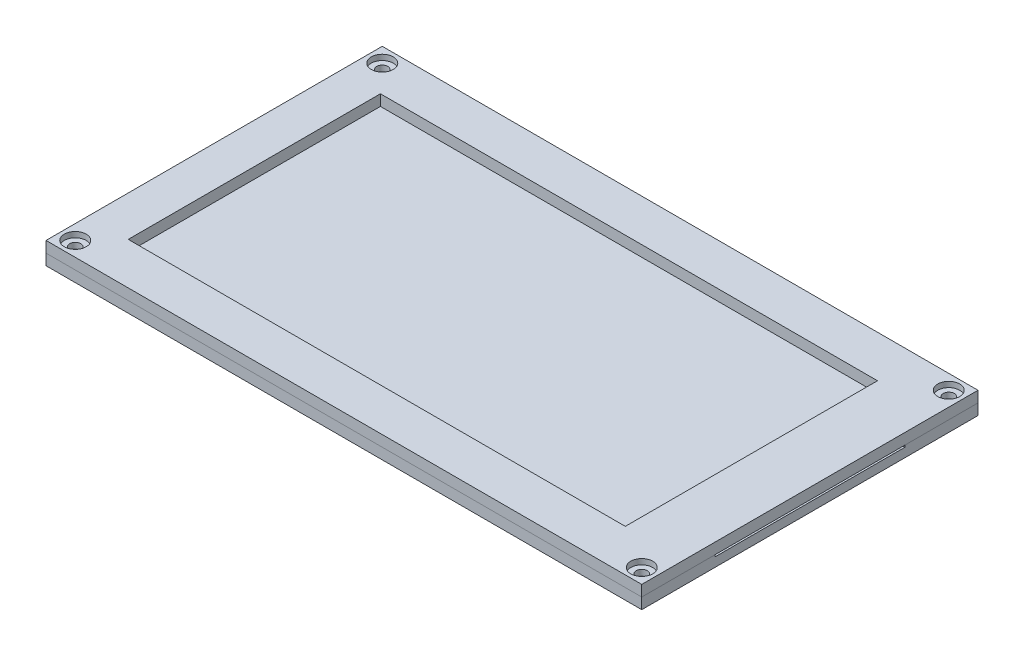
from build123d import *

# Parameters (mm, degrees)
SKETCH1_W           = 163
SKETCH1_H           = 92
SKETCH1_R           = 1.5
SKETCH1_W_2         = 136
SKETCH1_H_2         = 69
BOSS_EXTRUDE1_DEPTH = 3
SKETCH2_R           = 3
CUT_EXTRUDE1_DEPTH  = 1.5
SKETCH3_R           = 1.5
BOSS_EXTRUDE2_DEPTH = 0.5
BOSS_EXTRUDE3_START = 2.5
SKETCH4_W           = 163
SKETCH4_H           = 92
SKETCH4_R           = 1.5
BOSS_EXTRUDE3_DEPTH = 2.5


with BuildPart() as part:
    # Sketch1 → Boss-Extrude1 (new body)
    with BuildSketch(Plane(origin=(0, 0, 0), x_dir=(1, 0, 0), z_dir=(0, 1, 0))):
        with Locations((2.5, 0)):
            Rectangle(SKETCH1_W, SKETCH1_H)
        with Locations(Location((-75, 42, 0), (0, 0, 270))):
            Circle(SKETCH1_R, mode=Mode.SUBTRACT)
        with Locations(Location((80, 42, 0), (0, 0, 90))):
            Circle(SKETCH1_R, mode=Mode.SUBTRACT)
        with Locations(Location((80, -42, 0), (0, 0, 270))):
            Circle(SKETCH1_R, mode=Mode.SUBTRACT)
        with Locations(Location((-75, -42, 0), (0, 0, 90))):
            Circle(SKETCH1_R, mode=Mode.SUBTRACT)
        Rectangle(SKETCH1_W_2, SKETCH1_H_2, mode=Mode.SUBTRACT)
    extrude(amount=BOSS_EXTRUDE1_DEPTH)

    # Sketch2 → Cut-Extrude1 (cut)
    with BuildSketch(Plane(origin=(0, 3, 0), x_dir=(1, 0, 0), z_dir=(0, 1, 0))):
        with Locations(Location((-75, 42, 0), (0, 0, 270))):
            Circle(SKETCH2_R)
        with Locations(Location((80, 42, 0), (0, 0, 90))):
            Circle(SKETCH2_R)
        with Locations(Location((80, -42, 0), (0, 0, 270))):
            Circle(SKETCH2_R)
        with Locations(Location((-75, -42, 0), (0, 0, 90))):
            Circle(SKETCH2_R)
    extrude(amount=-CUT_EXTRUDE1_DEPTH, mode=Mode.SUBTRACT)


with BuildPart() as body_2:
    # Sketch3 → Boss-Extrude2 (new body)
    with BuildSketch(Plane.XZ):
        Polygon((84, 46), (-79, 46), (-79, -46), (84, -46), (84, -26), (76.5, -26), (76.5, -38.5), (-71.5, -38.5), (-71.5, 38.5), (76.5, 38.5), (76.5, 26), (84, 26), align=None)
        with Locations(Location((-75, -42, 0), (0, 0, 270))):
            Circle(SKETCH3_R, mode=Mode.SUBTRACT)
        with Locations(Location((80, -42, 0), (0, 0, 270))):
            Circle(SKETCH3_R, mode=Mode.SUBTRACT)
        with Locations(Location((-75, 42, 0), (0, 0, 270))):
            Circle(SKETCH3_R, mode=Mode.SUBTRACT)
        with Locations(Location((80, 42, 0), (0, 0, 270))):
            Circle(SKETCH3_R, mode=Mode.SUBTRACT)
    extrude(amount=BOSS_EXTRUDE2_DEPTH)

    # Sketch4 → Boss-Extrude3 (add)
    with BuildSketch(Plane.XZ.offset(0.5).offset(BOSS_EXTRUDE3_START)):
        with Locations((2.5, 0)):
            Rectangle(SKETCH4_W, SKETCH4_H)
        with Locations(Location((-75, 42, 0), (0, 0, 270))):
            Circle(SKETCH4_R, mode=Mode.SUBTRACT)
        with Locations(Location((80, 42, 0), (0, 0, 90))):
            Circle(SKETCH4_R, mode=Mode.SUBTRACT)
        with Locations(Location((80, -42, 0), (0, 0, 270))):
            Circle(SKETCH4_R, mode=Mode.SUBTRACT)
        with Locations(Location((-75, -42, 0), (0, 0, 90))):
            Circle(SKETCH4_R, mode=Mode.SUBTRACT)
    extrude(amount=-BOSS_EXTRUDE3_DEPTH)


solid = Compound([part.part, body_2.part])
